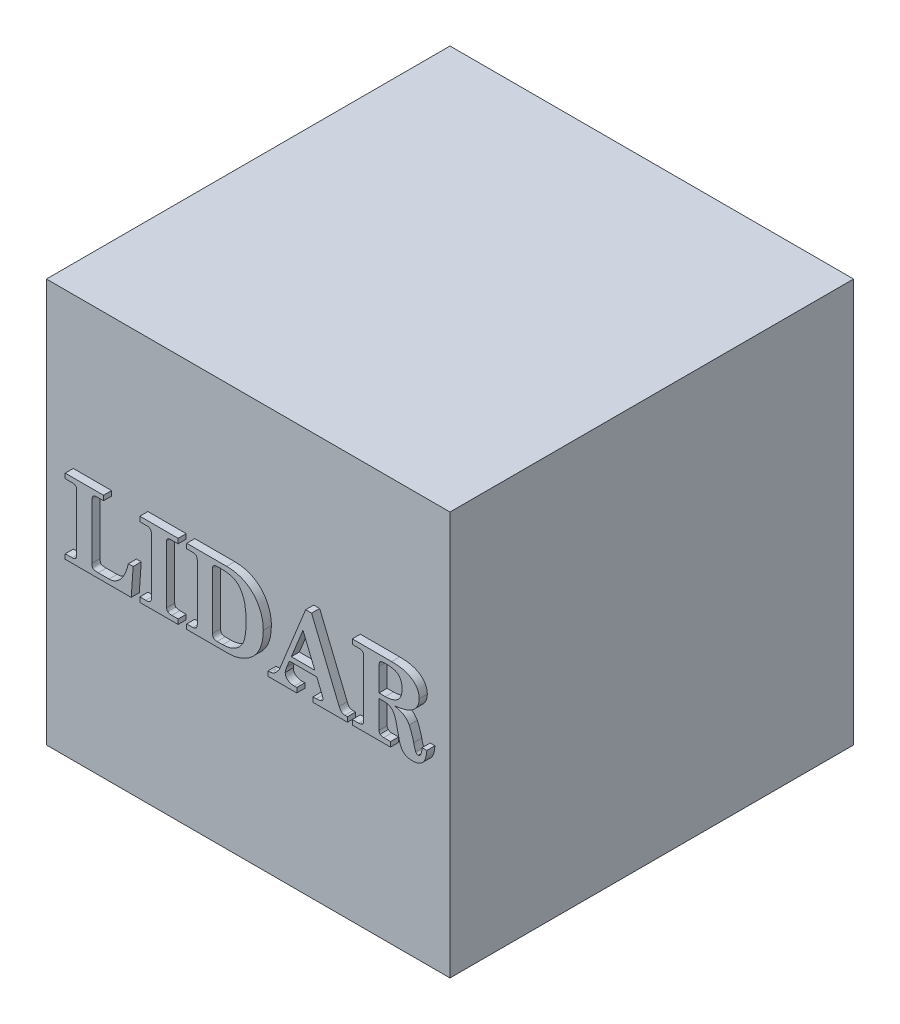
from build123d import *

# Parameters (mm, degrees)
SKETCH1_W           = 50
SKETCH1_H           = 50
BOSS_EXTRUDE1_DEPTH = 50
BOSS_EXTRUDE2_DEPTH = 1


with BuildPart() as part:
    # Sketch1 → Boss-Extrude1 (new body)
    with BuildSketch(Plane(origin=(0, 0, 0), x_dir=(1, 0, 0), z_dir=(0, 1, 0))):
        Rectangle(SKETCH1_W, SKETCH1_H)
    extrude(amount=BOSS_EXTRUDE1_DEPTH)

    # Sketch2 → Boss-Extrude2 (add)
    # profile 1 of 5: a face of its own
    with BuildSketch(Plane.XY.offset(25)):
        with BuildLine():
            Line((-21.67166408, 30.743259783), (-21.67166408, 31.33594871))
            Line((-21.67166408, 31.33594871), (-16.930152662, 31.33594871))
            Line((-16.930152662, 31.33594871), (-16.930152662, 30.743259783))
            Line((-16.930152662, 30.743259783), (-17.732134867, 30.743259783))
            add(Edge.make_bspline(
                [(-17.732134867, 30.743259783), (-17.785395123, 30.742532405), (-17.88403143, 30.741185325), (-18.019250989, 30.714301132), (-18.13106067, 30.676260377), (-18.218459156, 30.616349032), (-18.279457981, 30.535595339), (-18.322756283, 30.437503604), (-18.347754125, 30.319094115), (-18.350915588, 30.233423674), (-18.352606088, 30.187613913)],
                knots=[0, 0, 0, 0, 1.317174052, 2.439364582, 3.40274332, 4.226216974, 5.021934816, 5.877883306, 6.86526021, 8, 8, 8, 8], degree=3))
            Line((-18.352606088, 30.187613913), (-18.352606088, 23.330943886))
            add(Edge.make_bspline(
                [(-18.352606088, 23.330943886), (-18.351933156, 23.267846661), (-18.350711833, 23.153329748), (-18.324998572, 22.999808731), (-18.28729014, 22.881026478), (-18.22548858, 22.789740065), (-18.121326525, 22.738458675), (-17.984594796, 22.707359551), (-17.804369536, 22.685405408), (-17.669846737, 22.68366033), (-17.595075552, 22.682690372)],
                knots=[0, 0, 0, 0, 1.253318516, 2.274682744, 3.08242206, 3.723352428, 4.399534733, 5.325689848, 6.513550565, 8, 8, 8, 8], degree=3))
            Line((-17.595075552, 22.682690372), (-16.248560396, 22.682690372))
            add(Edge.make_bspline(
                [(-16.248560396, 22.682690372), (-16.186061304, 22.684911681), (-16.061513477, 22.689338293), (-15.877162703, 22.722496236), (-15.695405202, 22.773247908), (-15.519578701, 22.852058666), (-15.343973867, 22.945616543), (-15.173747591, 23.063802403), (-15.006077722, 23.202116505), (-14.841450493, 23.36086045), (-14.682807008, 23.543404641), (-14.534829608, 23.752254471), (-14.395996963, 23.986619867), (-14.267027413, 24.246393043), (-14.147067434, 24.530488149), (-14.035071326, 24.839204345), (-13.936566429, 25.174496039), (-13.878208196, 25.407609722), (-13.84817024, 25.527597223)],
                knots=[0, 0, 0, 0, 0.746952398, 1.488522408, 2.233867827, 2.997739128, 3.787258218, 4.610437708, 5.470623944, 6.384302497, 7.342016262, 8.35813022, 9.440650158, 10.596202486, 11.823439516, 13.126538548, 14.520981459, 16, 16, 16, 16], degree=3))
            Line((-13.84817024, 25.527597223), (-13.255481313, 25.527597223))
            Line((-13.255481313, 25.527597223), (-13.492556884, 22.090001444))
            Line((-13.492556884, 22.090001444), (-21.67166408, 22.090001444))
            Line((-21.67166408, 22.090001444), (-21.67166408, 22.682690372))
            Line((-21.67166408, 22.682690372), (-20.819673748, 22.682690372))
            add(Edge.make_bspline(
                [(-20.819673748, 22.682690372), (-20.775725801, 22.684487061), (-20.691929215, 22.68791285), (-20.574783474, 22.712742088), (-20.474869844, 22.756670447), (-20.390977358, 22.815885876), (-20.3278065, 22.894434519), (-20.279366297, 22.985026653), (-20.254459982, 23.091980068), (-20.251021274, 23.167228369), (-20.249210655, 23.206849642)],
                knots=[0, 0, 0, 0, 1.195528741, 2.279542841, 3.234602015, 4.14844858, 5.043106676, 5.952155301, 6.921726988, 8, 8, 8, 8], degree=3))
            Line((-20.249210655, 23.206849642), (-20.249210655, 30.256143571))
            add(Edge.make_bspline(
                [(-20.249210655, 30.256143571), (-20.250768412, 30.295831407), (-20.253709545, 30.370764267), (-20.281198772, 30.47485286), (-20.328575695, 30.561840477), (-20.396889387, 30.631728422), (-20.48789711, 30.68507565), (-20.604840397, 30.717896272), (-20.745971948, 30.740081095), (-20.849197471, 30.742146041), (-20.904872781, 30.743259783)],
                knots=[0, 0, 0, 0, 1.00990991, 1.906766507, 2.716615905, 3.506507968, 4.367174043, 5.37229384, 6.582730811, 8, 8, 8, 8], degree=3))
            Line((-20.904872781, 30.743259783), (-21.67166408, 30.743259783))
        make_face()
    # profile 2 of 5: a face of its own
    with BuildSketch(Plane.XY.offset(25)):
        with BuildLine():
            Line((-12.425716815, 31.33594871), (-7.684205397, 31.33594871))
            Line((-7.684205397, 31.33594871), (-7.684205397, 30.743259783))
            Line((-7.684205397, 30.743259783), (-8.565830176, 30.743259783))
            add(Edge.make_bspline(
                [(-8.565830176, 30.743259783), (-8.609767253, 30.741925445), (-8.692001207, 30.739428058), (-8.806131446, 30.719138426), (-8.902852094, 30.68750997), (-8.979914699, 30.638148777), (-9.037481067, 30.574188003), (-9.078694302, 30.498818753), (-9.103696407, 30.410178014), (-9.105631204, 30.347075568), (-9.106658822, 30.31356031)],
                knots=[0, 0, 0, 0, 1.332052342, 2.493109215, 3.506175236, 4.399811825, 5.235207467, 6.090320786, 6.985722488, 8, 8, 8, 8], degree=3))
            Line((-9.106658822, 30.31356031), (-9.106658822, 23.175363042))
            add(Edge.make_bspline(
                [(-9.106658822, 23.175363042), (-9.104913864, 23.13629211), (-9.101688951, 23.064083845), (-9.077497174, 22.963747216), (-9.036489874, 22.879161745), (-8.992567368, 22.839038771), (-8.971451661, 22.819749686)],
                knots=[0, 0, 0, 0, 1.190089479, 2.199443223, 3.134383883, 4, 4, 4, 4], degree=3))
            add(Edge.make_bspline(
                [(-8.971451661, 22.819749686), (-8.940096484, 22.798553309), (-8.874299889, 22.754074228), (-8.754701361, 22.713851199), (-8.6182541, 22.687500255), (-8.52091411, 22.684352433), (-8.469518225, 22.682690372)],
                knots=[0, 0, 0, 0, 0.855129119, 1.794427274, 2.835449219, 4, 4, 4, 4], degree=3))
            Line((-8.469518225, 22.682690372), (-7.684205397, 22.682690372))
            Line((-7.684205397, 22.682690372), (-7.684205397, 22.090001444))
            Line((-7.684205397, 22.090001444), (-12.425716815, 22.090001444))
            Line((-12.425716815, 22.090001444), (-12.425716815, 22.682690372))
            Line((-12.425716815, 22.682690372), (-11.692264267, 22.682690372))
            add(Edge.make_bspline(
                [(-11.692264267, 22.682690372), (-11.633509513, 22.68368567), (-11.524672443, 22.685529356), (-11.375683001, 22.709057712), (-11.253896858, 22.746511226), (-11.157866999, 22.8014982), (-11.086763141, 22.874500372), (-11.038426272, 22.962435929), (-11.00699507, 23.063990609), (-11.004554605, 23.136826575), (-11.003263389, 23.175363042)],
                knots=[0, 0, 0, 0, 1.452026474, 2.689728013, 3.718337889, 4.587844334, 5.397781197, 6.204689171, 7.050126734, 8, 8, 8, 8], degree=3))
            Line((-11.003263389, 23.175363042), (-11.003263389, 30.232065583))
            add(Edge.make_bspline(
                [(-11.003263389, 30.232065583), (-11.005009339, 30.272948375), (-11.008303534, 30.350084549), (-11.033362674, 30.457759381), (-11.078651943, 30.548507737), (-11.144403583, 30.621170236), (-11.228078429, 30.677956632), (-11.332136417, 30.716385758), (-11.454721937, 30.740184815), (-11.543350295, 30.742193524), (-11.590395858, 30.743259783)],
                knots=[0, 0, 0, 0, 1.095815606, 2.067545285, 2.941247535, 3.785432335, 4.66709808, 5.626336411, 6.740015708, 8, 8, 8, 8], degree=3))
            Line((-11.590395858, 30.743259783), (-12.425716815, 30.743259783))
            Line((-12.425716815, 30.743259783), (-12.425716815, 31.33594871))
        make_face()
    # profile 3 of 5: a face of its own
    with BuildSketch(Plane.XY.offset(25)):
        with BuildLine():
            Line((-6.617365327, 31.33594871), (-1.673969243, 31.33594871))
            add(Edge.make_bspline(
                [(-1.673969243, 31.33594871), (-1.563417473, 31.333987755), (-1.34509672, 31.330115205), (-1.02260868, 31.304881734), (-0.711076623, 31.257841258), (-0.409986851, 31.19457888), (-0.11827461, 31.116423292), (0.161733332, 31.014622446), (0.43294554, 30.898948435), (0.692467754, 30.763036824), (0.939484334, 30.611405197), (1.175706267, 30.446445625), (1.394543453, 30.261911061), (1.604024491, 30.066119596), (1.795545026, 29.852283594), (1.975758912, 29.624944193), (2.138714287, 29.380246768), (2.291816564, 29.123518394), (2.425201285, 28.85334409), (2.545747677, 28.575527729), (2.642311403, 28.287342683), (2.725220097, 27.992198074), (2.787103061, 27.687469429), (2.834433874, 27.37482883), (2.859789132, 27.05357712), (2.863688391, 26.837108534), (2.865657509, 26.7277923)],
                knots=[0, 0, 0, 0, 1.095124878, 2.162683496, 3.201422963, 4.213739968, 5.209254947, 6.189989335, 7.162451537, 8.128043583, 9.088801183, 10.032215269, 10.978894355, 11.921971404, 12.870209753, 13.819610945, 14.793226264, 15.780195082, 16.778467595, 17.775821777, 18.777628539, 19.786559333, 20.810849883, 21.85563876, 22.91710156, 24, 24, 24, 24], degree=3))
            add(Edge.make_bspline(
                [(2.865657509, 26.7277923), (2.864642001, 26.614749213), (2.862641448, 26.392054078), (2.834609377, 26.063335619), (2.795401064, 25.745317741), (2.737647861, 25.438555148), (2.663703545, 25.143441406), (2.572940868, 24.859393305), (2.465281343, 24.586542756), (2.341698767, 24.324930388), (2.199595134, 24.076501272), (2.04530393, 23.838511095), (1.870984829, 23.615613973), (1.683043039, 23.403760339), (1.475285789, 23.20735953), (1.253884883, 23.021182271), (1.013137443, 22.851775219), (0.761215469, 22.69239906), (0.498065227, 22.550942276), (0.228183448, 22.428100097), (-0.046508876, 22.324104925), (-0.326787281, 22.238666298), (-0.612091519, 22.172230872), (-0.902088161, 22.123411564), (-1.196789673, 22.095433619), (-1.39485453, 22.091817324), (-1.494310412, 22.090001444)],
                knots=[0, 0, 0, 0, 1.13887174, 2.243579878, 3.322457727, 4.367025756, 5.387125682, 6.38669751, 7.369928061, 8.341215495, 9.299704588, 10.252278776, 11.196874661, 12.148635726, 13.103584326, 14.075469414, 15.061295075, 16.067717662, 17.078228411, 18.069458256, 19.054006876, 20.036134399, 21.020132398, 22.004130398, 22.997798122, 24, 24, 24, 24], degree=3))
            Line((-1.494310412, 22.090001444), (-6.617365327, 22.090001444))
            Line((-6.617365327, 22.090001444), (-6.617365327, 22.682690372))
            Line((-6.617365327, 22.682690372), (-5.867243404, 22.682690372))
            add(Edge.make_bspline(
                [(-5.867243404, 22.682690372), (-5.824424665, 22.684073905), (-5.74257352, 22.68671863), (-5.629003312, 22.717192303), (-5.530226102, 22.763293599), (-5.450405683, 22.832361757), (-5.389810232, 22.91901695), (-5.343676178, 23.01975879), (-5.31869368, 23.136516595), (-5.31525441, 23.219086512), (-5.313449687, 23.262414229)],
                knots=[0, 0, 0, 0, 1.122856504, 2.146422164, 3.068293037, 3.966132366, 4.88499783, 5.829313612, 6.860954614, 8, 8, 8, 8], degree=3))
            Line((-5.313449687, 23.262414229), (-5.313449687, 30.207987595))
            add(Edge.make_bspline(
                [(-5.313449687, 30.207987595), (-5.315018456, 30.251369305), (-5.317991441, 30.333582328), (-5.345251681, 30.447019352), (-5.39053667, 30.543093527), (-5.45745519, 30.619927785), (-5.548230178, 30.677285398), (-5.66136241, 30.716847223), (-5.798990554, 30.740368729), (-5.898625772, 30.742245869), (-5.952442437, 30.743259783)],
                knots=[0, 0, 0, 0, 1.078064526, 2.043048672, 2.881216632, 3.697706621, 4.541346901, 5.523059816, 6.66211301, 8, 8, 8, 8], degree=3))
            Line((-5.952442437, 30.743259783), (-6.617365327, 30.743259783))
            Line((-6.617365327, 30.743259783), (-6.617365327, 31.33594871))
        make_face()
        with BuildLine():
            add(Edge.make_bspline(
                [(-2.153676844, 22.682690372), (-2.080160264, 22.684200876), (-1.935314264, 22.687176946), (-1.721254536, 22.708161223), (-1.513415086, 22.741487249), (-1.311236267, 22.787000314), (-1.116506056, 22.84872264), (-0.928405006, 22.923134933), (-0.746573309, 23.010599686), (-0.57067308, 23.109729663), (-0.405035083, 23.223079783), (-0.248252361, 23.344619744), (-0.106428969, 23.478553457), (0.024969163, 23.62026226), (0.143756652, 23.772797889), (0.250504391, 23.935263087), (0.346300429, 24.106898248), (0.428565208, 24.291824953), (0.501333121, 24.494103969), (0.564539697, 24.719256238), (0.614692635, 24.970947274), (0.659610305, 25.24693647), (0.6918528, 25.549325969), (0.716262336, 25.876680363), (0.727949363, 26.23009776), (0.730605808, 26.474041774), (0.731977371, 26.59999375)],
                knots=[0, 0, 0, 0, 0.949765025, 1.871273987, 2.776130108, 3.66816782, 4.546113786, 5.412643397, 6.279613467, 7.151267918, 8.018531503, 8.870659598, 9.711550513, 10.535742305, 11.365473911, 12.206175636, 13.045248569, 13.902142185, 14.818075952, 15.820638119, 16.9204126, 18.132138158, 19.432318017, 20.847999306, 22.372574464, 24, 24, 24, 24], degree=3))
            add(Edge.make_bspline(
                [(0.731977371, 26.59999375), (0.731000493, 26.733370139), (0.729104717, 26.992206665), (0.711961982, 27.368367336), (0.685750154, 27.72075872), (0.643726695, 28.04854107), (0.59622288, 28.352714959), (0.531506856, 28.631550496), (0.461592013, 28.88810985), (0.375168661, 29.120753979), (0.280003145, 29.333016181), (0.178239198, 29.529055398), (0.06673898, 29.708733846), (-0.051335447, 29.873935511), (-0.177395615, 30.023605592), (-0.313664625, 30.155099159), (-0.456004511, 30.272697266), (-0.608761079, 30.374271167), (-0.774730107, 30.462856697), (-0.957820405, 30.538246376), (-1.159242276, 30.599878669), (-1.377046539, 30.654899826), (-1.613688209, 30.694672693), (-1.868617703, 30.720990644), (-2.141016692, 30.741030106), (-2.328973378, 30.74250095), (-2.42594332, 30.743259783)],
                knots=[0, 0, 0, 0, 1.586297713, 3.07844435, 4.478005486, 5.787764439, 7.008271247, 8.137702286, 9.190763021, 10.168851427, 11.085936446, 11.956353167, 12.7939037, 13.598887414, 14.369895025, 15.117682938, 15.848254541, 16.563120313, 17.29571888, 18.082579543, 18.914023681, 19.799183864, 20.752903796, 21.764942868, 22.846897305, 24, 24, 24, 24], degree=3))
            add(Edge.make_bspline(
                [(-2.42594332, 30.743259783), (-2.478429612, 30.743008971), (-2.577878122, 30.742533744), (-2.719868949, 30.736212323), (-2.845943116, 30.729721998), (-2.957396668, 30.719255581), (-3.052503438, 30.702521417), (-3.132785829, 30.683852086), (-3.19918032, 30.665210973), (-3.264599941, 30.631110588), (-3.329116265, 30.575235416), (-3.382398088, 30.485944607), (-3.410692197, 30.37448136), (-3.414691022, 30.293961674), (-3.41684512, 30.250587112)],
                knots=[0, 0, 0, 0, 1.479388087, 2.803073613, 4.005921637, 5.038015802, 5.956445119, 6.724759669, 7.363251975, 7.892554548, 8.792999824, 9.730199517, 10.777297743, 12, 12, 12, 12], degree=3))
            Line((-3.41684512, 30.250587112), (-3.41684512, 23.26982284))
            add(Edge.make_bspline(
                [(-3.41684512, 23.26982284), (-3.414996453, 23.220965771), (-3.411576798, 23.130590215), (-3.388878827, 23.004628631), (-3.346213671, 22.901262999), (-3.287654633, 22.816708142), (-3.206576103, 22.754727784), (-3.106904152, 22.713760796), (-2.988499761, 22.687122688), (-2.90334927, 22.684241772), (-2.857494945, 22.682690372)],
                knots=[0, 0, 0, 0, 1.25011308, 2.312452742, 3.253936465, 4.091094141, 4.912462066, 5.824887263, 6.828681705, 8, 8, 8, 8], degree=3))
            Line((-2.857494945, 22.682690372), (-2.153676844, 22.682690372))
        make_face(mode=Mode.SUBTRACT)
    # profile 4 of 5: a face of its own
    with BuildSketch(Plane.XY.offset(25)):
        with BuildLine():
            Line((8.849963522, 31.573024281), (12.267185618, 23.271674993))
            add(Edge.make_bspline(
                [(12.267185618, 23.271674993), (12.289712528, 23.218764772), (12.331626789, 23.120318391), (12.403915341, 22.988723684), (12.478998127, 22.883963932), (12.5591395, 22.802923047), (12.650418185, 22.747196486), (12.752269562, 22.711581766), (12.865377115, 22.685527562), (12.945520502, 22.683668285), (12.987673095, 22.682690372)],
                knots=[0, 0, 0, 0, 1.370087271, 2.549226437, 3.57052343, 4.434214329, 5.246883247, 6.094249163, 6.997642324, 8, 8, 8, 8], degree=3))
            Line((12.987673095, 22.682690372), (13.296982629, 22.682690372))
            Line((13.296982629, 22.682690372), (13.296982629, 22.090001444))
            Line((13.296982629, 22.090001444), (9.029622353, 22.090001444))
            Line((9.029622353, 22.090001444), (9.029622353, 22.682690372))
            Line((9.029622353, 22.682690372), (9.429687379, 22.682690372))
            add(Edge.make_bspline(
                [(9.429687379, 22.682690372), (9.50255491, 22.684262903), (9.635604924, 22.687134215), (9.817837162, 22.703374873), (9.962831831, 22.735813533), (10.076624519, 22.778710998), (10.1568428, 22.839652385), (10.217126116, 22.904066276), (10.253510628, 22.980690462), (10.257449611, 23.034850875), (10.259451877, 23.062381716)],
                knots=[0, 0, 0, 0, 1.734001692, 3.166141951, 4.34179556, 5.263658256, 6.030315746, 6.716978054, 7.34781383, 8, 8, 8, 8], degree=3))
            add(Edge.make_bspline(
                [(10.259451877, 23.062381716), (10.255416599, 23.111641911), (10.246573858, 23.219588647), (10.206922628, 23.320521951), (10.185365761, 23.375395555)],
                knots=[0, 0, 0, 0, 0.912675961, 2, 2, 2, 2], degree=3))
            Line((10.185365761, 23.375395555), (9.49451273, 25.053446081))
            Line((9.49451273, 25.053446081), (6.101368621, 25.053446081))
            Line((6.101368621, 25.053446081), (5.790206935, 24.288506934))
            add(Edge.make_bspline(
                [(5.790206935, 24.288506934), (5.758971037, 24.21416554), (5.701479354, 24.077335417), (5.636107218, 23.883919065), (5.592936503, 23.72113456), (5.58587793, 23.62129807), (5.58276581, 23.577280221)],
                knots=[0, 0, 0, 0, 1.298659012, 2.390265557, 3.29026905, 4, 4, 4, 4], degree=3))
            add(Edge.make_bspline(
                [(5.58276581, 23.577280221), (5.585958987, 23.513830326), (5.592206434, 23.389690696), (5.652175419, 23.213878518), (5.749422683, 23.057059091), (5.885399226, 22.923771256), (6.05210611, 22.813603472), (6.250910672, 22.738816979), (6.474275116, 22.688974874), (6.633252354, 22.684846532), (6.716283384, 22.682690372)],
                knots=[0, 0, 0, 0, 0.936681703, 1.832616438, 2.715165993, 3.645764122, 4.629294347, 5.650980637, 6.773148287, 8, 8, 8, 8], degree=3))
            Line((6.716283384, 22.682690372), (7.01448, 22.682690372))
            Line((7.01448, 22.682690372), (7.01448, 22.090001444))
            Line((7.01448, 22.090001444), (3.458346436, 22.090001444))
            Line((3.458346436, 22.090001444), (3.458346436, 22.682690372))
            Line((3.458346436, 22.682690372), (3.67134402, 22.682690372))
            add(Edge.make_bspline(
                [(3.67134402, 22.682690372), (3.72962634, 22.685029686), (3.843848017, 22.689614275), (4.008956617, 22.730277522), (4.163973862, 22.794540842), (4.255160404, 22.858118121), (4.301076005, 22.890131496)],
                knots=[0, 0, 0, 0, 1.034931053, 2.028257604, 3.007159006, 4, 4, 4, 4], degree=3))
            add(Edge.make_bspline(
                [(4.301076005, 22.890131496), (4.362945734, 22.941140065), (4.486604261, 23.043090477), (4.648298759, 23.223276387), (4.788481458, 23.423652926), (4.862163903, 23.57010372), (4.899321391, 23.643957726)],
                knots=[0, 0, 0, 0, 0.989267864, 1.977241644, 2.979938569, 4, 4, 4, 4], degree=3))
            Line((4.899321391, 23.643957726), (8.114658821, 31.573024281))
            Line((8.114658821, 31.573024281), (8.849963522, 31.573024281))
        make_face()
        Polygon((7.784975606, 29.20782503), (6.340296345, 25.646135008), (9.250028548, 25.646135008), align=None, mode=Mode.SUBTRACT)
    # profile 5 of 5: a face of its own
    with BuildSketch(Plane.XY.offset(25)):
        with BuildLine():
            Line((13.889671557, 31.33594871), (18.768242289, 31.33594871))
            add(Edge.make_bspline(
                [(18.768242289, 31.33594871), (18.865180036, 31.334577055), (19.054200687, 31.331902442), (19.331107463, 31.319949023), (19.594258952, 31.295380937), (19.844005847, 31.262659209), (20.079501281, 31.220060702), (20.301289182, 31.169005288), (20.508415291, 31.105000483), (20.703898113, 31.035694275), (20.884925057, 30.955219962), (21.054809675, 30.870169842), (21.212672265, 30.777451622), (21.358584842, 30.677668815), (21.493153365, 30.572168477), (21.614052841, 30.458236002), (21.723884747, 30.337623301), (21.853087321, 30.168914556), (21.987465994, 29.945665677), (22.104335102, 29.659871041), (22.175232237, 29.358835574), (22.183262513, 29.152637459), (22.187316539, 29.048539881)],
                knots=[0, 0, 0, 0, 1.260796864, 2.458450407, 3.603348749, 4.696868034, 5.733149247, 6.714703153, 7.654483761, 8.551049231, 9.410311666, 10.229003047, 11.020794849, 11.789116025, 12.526438116, 13.242153704, 13.946977727, 14.645554491, 16.003253973, 17.321296627, 18.647676625, 20, 20, 20, 20], degree=3))
            add(Edge.make_bspline(
                [(22.187316539, 29.048539881), (22.184419206, 28.965623272), (22.178714946, 28.802377272), (22.13499761, 28.563247798), (22.06348981, 28.335996191), (21.959242866, 28.122679254), (21.828624088, 27.920668683), (21.667890901, 27.731160095), (21.478100957, 27.5540954), (21.334699891, 27.451055639), (21.26124009, 27.398271649)],
                knots=[0, 0, 0, 0, 1.006615866, 1.981822625, 2.942272039, 3.891414032, 4.85650664, 5.856958922, 6.902188287, 8, 8, 8, 8], degree=3))
            add(Edge.make_bspline(
                [(21.26124009, 27.398271649), (21.199562417, 27.358822683), (21.071086254, 27.276649483), (20.857868895, 27.172716843), (20.620700475, 27.080530307), (20.360778823, 26.997559363), (20.077669414, 26.923747125), (19.770389049, 26.860989574), (19.439691896, 26.809311235), (19.210412171, 26.784841862), (19.092369046, 26.77224397)],
                knots=[0, 0, 0, 0, 0.770522959, 1.605018928, 2.492419048, 3.448517842, 4.476706657, 5.572020456, 6.749971061, 8, 8, 8, 8], degree=3))
            add(Edge.make_bspline(
                [(19.092369046, 26.77224397), (19.209423895, 26.751189402), (19.431175784, 26.711303056), (19.740066044, 26.62741439), (20.005916621, 26.52372647), (20.235662001, 26.401750774), (20.435962293, 26.251182564), (20.619973446, 26.073977084), (20.791584528, 25.864661007), (20.891190457, 25.708382765), (20.942669791, 25.627613479)],
                knots=[0, 0, 0, 0, 1.260855103, 2.388598191, 3.387941535, 4.281421676, 5.137767289, 6.036055688, 6.984974634, 8, 8, 8, 8], degree=3))
            add(Edge.make_bspline(
                [(20.942669791, 25.627613479), (20.998818345, 25.50861053), (21.114598666, 25.263222202), (21.257911538, 24.868169415), (21.391379622, 24.44162196), (21.461918867, 24.142697176), (21.498315661, 23.988458165)],
                knots=[0, 0, 0, 0, 0.909803941, 1.87604819, 2.904084753, 4, 4, 4, 4], degree=3))
            add(Edge.make_bspline(
                [(21.498315661, 23.988458165), (21.519920525, 23.894463497), (21.559745728, 23.721198969), (21.622883878, 23.48630443), (21.686380052, 23.299116446), (21.734694579, 23.193598104), (21.755764913, 23.147580749)],
                knots=[0, 0, 0, 0, 1.313125144, 2.420541671, 3.311186147, 4, 4, 4, 4], degree=3))
            add(Edge.make_bspline(
                [(21.755764913, 23.147580749), (21.775276068, 23.113129474), (21.811003977, 23.050043919), (21.880859218, 22.978422926), (21.954071219, 22.929071509), (22.007630223, 22.922803677), (22.033587848, 22.919765943)],
                knots=[0, 0, 0, 0, 1.257126063, 2.301990172, 3.177051494, 4, 4, 4, 4], degree=3))
            add(Edge.make_bspline(
                [(22.033587848, 22.919765943), (22.068269222, 22.922761478), (22.13722199, 22.928717139), (22.231475983, 22.985446056), (22.311734602, 23.072739819), (22.38214683, 23.19192841), (22.437247282, 23.344998895), (22.485038481, 23.529077015), (22.521282363, 23.746665218), (22.535399134, 23.903135211), (22.542929895, 23.986606012)],
                knots=[0, 0, 0, 0, 0.646043871, 1.28445065, 2.005958554, 2.858823567, 3.864198261, 5.050731084, 6.426677019, 8, 8, 8, 8], degree=3))
            Line((22.542929895, 23.986606012), (23.135618822, 23.986606012))
            add(Edge.make_bspline(
                [(23.135618822, 23.986606012), (23.129150487, 23.899462333), (23.11668323, 23.731499066), (23.083424211, 23.489545543), (23.038213471, 23.266999291), (22.977872532, 23.063745018), (22.909360454, 22.877898075), (22.824877505, 22.712210444), (22.73141646, 22.563949313), (22.622022502, 22.437148421), (22.502413739, 22.325976577), (22.369471336, 22.232034806), (22.227124119, 22.149171251), (22.070836986, 22.085090199), (21.904519272, 22.032180969), (21.725303253, 21.99878354), (21.535370221, 21.975160164), (21.404553896, 21.97272029), (21.337178358, 21.971463659)],
                knots=[0, 0, 0, 0, 1.367110356, 2.635008363, 3.819206984, 4.916686227, 5.950176123, 6.913653537, 7.822085834, 8.685534134, 9.526475961, 10.371017135, 11.227791915, 12.098023441, 13.008610734, 13.954046558, 14.946253751, 16, 16, 16, 16], degree=3))
            add(Edge.make_bspline(
                [(21.337178358, 21.971463659), (21.243108119, 21.973787376), (21.064185572, 21.978207111), (20.809671283, 22.025524149), (20.583763859, 22.101652138), (20.386225984, 22.211928191), (20.214691886, 22.35132679), (20.068037799, 22.521140697), (19.93978995, 22.716842574), (19.876756594, 22.863085415), (19.844343123, 22.938287472)],
                knots=[0, 0, 0, 0, 1.180805118, 2.245903272, 3.239527271, 4.163314747, 5.073219269, 6.002236293, 6.972695423, 8, 8, 8, 8], degree=3))
            add(Edge.make_bspline(
                [(19.844343123, 22.938287472), (19.83413793, 22.964722476), (19.811127976, 23.024326267), (19.780805594, 23.127497886), (19.745293155, 23.252586212), (19.709156766, 23.401187661), (19.668060296, 23.572116644), (19.623693496, 23.765873235), (19.577274302, 23.98319175), (19.54715905, 24.135967827), (19.531329283, 24.216272971)],
                knots=[0, 0, 0, 0, 0.51621077, 1.16391579, 1.958305469, 2.886107817, 3.950407662, 5.162257264, 6.508370262, 8, 8, 8, 8], degree=3))
            add(Edge.make_bspline(
                [(19.531329283, 24.216272971), (19.512377334, 24.310153343), (19.476052886, 24.490090118), (19.420821162, 24.748397554), (19.365503939, 24.98234862), (19.311788398, 25.192297731), (19.260285018, 25.377683156), (19.210323799, 25.538898142), (19.163330474, 25.676799145), (19.100057815, 25.82456937), (19.016339995, 25.982855681), (18.904625679, 26.149952514), (18.775031602, 26.288293802), (18.632563428, 26.402851904), (18.471639562, 26.48779158), (18.295927862, 26.552873905), (18.100866251, 26.586387857), (17.965749494, 26.5916936), (17.895878274, 26.594437292)],
                knots=[0, 0, 0, 0, 1.442191922, 2.764191877, 3.977370359, 5.061944357, 6.027372746, 6.874242926, 7.603428871, 8.219893778, 9.292850582, 10.295949872, 11.236574786, 12.136774613, 13.035292675, 13.964593533, 14.947456001, 16, 16, 16, 16], degree=3))
            Line((17.895878274, 26.594437292), (17.208729549, 26.594437292))
            Line((17.208729549, 26.594437292), (17.208729549, 23.182771654))
            add(Edge.make_bspline(
                [(17.208729549, 23.182771654), (17.210659843, 23.147447914), (17.21433298, 23.080230714), (17.237842863, 22.984998143), (17.281019583, 22.903110781), (17.321907498, 22.859695474), (17.342084558, 22.838271215)],
                knots=[0, 0, 0, 0, 1.11562849, 2.122918543, 3.073711999, 4, 4, 4, 4], degree=3))
            add(Edge.make_bspline(
                [(17.342084558, 22.838271215), (17.373948379, 22.814001203), (17.437145369, 22.765865366), (17.547081824, 22.718934555), (17.663172851, 22.687146721), (17.743778446, 22.684192142), (17.784749101, 22.682690372)],
                knots=[0, 0, 0, 0, 1.000506897, 1.984351599, 2.975475153, 4, 4, 4, 4], degree=3))
            Line((17.784749101, 22.682690372), (18.631182975, 22.682690372))
            Line((18.631182975, 22.682690372), (18.631182975, 22.090001444))
            Line((18.631182975, 22.090001444), (13.889671557, 22.090001444))
            Line((13.889671557, 22.090001444), (13.889671557, 22.682690372))
            Line((13.889671557, 22.682690372), (14.686097303, 22.682690372))
            add(Edge.make_bspline(
                [(14.686097303, 22.682690372), (14.734411237, 22.684263096), (14.826373086, 22.687256654), (14.954134225, 22.714794367), (15.064976641, 22.759213391), (15.154301281, 22.825523348), (15.227651249, 22.906511163), (15.277242081, 23.005132867), (15.308058433, 23.117334716), (15.310727481, 23.196753146), (15.312124982, 23.238336241)],
                knots=[0, 0, 0, 0, 1.215748592, 2.314083659, 3.276082243, 4.200108988, 5.092704252, 6.004076111, 6.954944175, 8, 8, 8, 8], degree=3))
            Line((15.312124982, 23.238336241), (15.312124982, 30.187613913))
            add(Edge.make_bspline(
                [(15.312124982, 30.187613913), (15.31036057, 30.232177351), (15.307042293, 30.315986498), (15.282315624, 30.433730875), (15.235742924, 30.532119522), (15.170275045, 30.611153249), (15.088168587, 30.671660359), (14.990168296, 30.714461813), (14.876687708, 30.737629366), (14.796711134, 30.741318524), (14.75462696, 30.743259783)],
                knots=[0, 0, 0, 0, 1.186255313, 2.230955505, 3.179282011, 4.054730626, 4.935716216, 5.870269018, 6.87932221, 8, 8, 8, 8], degree=3))
            Line((14.75462696, 30.743259783), (13.889671557, 30.743259783))
            Line((13.889671557, 30.743259783), (13.889671557, 31.33594871))
        make_face()
        with BuildLine():
            Line((17.208729549, 27.187126219), (17.982929461, 27.187126219))
            add(Edge.make_bspline(
                [(17.982929461, 27.187126219), (18.066361113, 27.188112428), (18.229335182, 27.190038874), (18.466858613, 27.217758537), (18.691372337, 27.257036916), (18.902257729, 27.314631212), (19.098993525, 27.389350783), (19.283996733, 27.477286248), (19.453489168, 27.585558394), (19.556181052, 27.669517868), (19.607267552, 27.711285489)],
                knots=[0, 0, 0, 0, 1.146952266, 2.240438413, 3.284842864, 4.279918954, 5.24205365, 6.176390374, 7.092802377, 8, 8, 8, 8], degree=3))
            add(Edge.make_bspline(
                [(19.607267552, 27.711285489), (19.642929179, 27.746762971), (19.715335426, 27.818795335), (19.805590453, 27.94703501), (19.883982177, 28.090259932), (19.947155897, 28.251475875), (19.994034075, 28.430069119), (20.029446785, 28.62506533), (20.04926908, 28.837604491), (20.052142352, 28.984909199), (20.0536364, 29.061504952)],
                knots=[0, 0, 0, 0, 0.823637118, 1.672286907, 2.560369197, 3.496721298, 4.503762865, 5.584178681, 6.743817119, 8, 8, 8, 8], degree=3))
            add(Edge.make_bspline(
                [(20.0536364, 29.061504952), (20.052182773, 29.131940392), (20.049371105, 29.268179639), (20.02873797, 29.4650699), (19.996042002, 29.648096731), (19.948755, 29.816707004), (19.885241273, 29.969939991), (19.808490659, 30.108237294), (19.720379474, 30.233783211), (19.614131114, 30.342826202), (19.492281384, 30.438491645), (19.350592703, 30.520678821), (19.189423646, 30.590042406), (19.007937302, 30.648363396), (18.805774755, 30.688776914), (18.584407551, 30.720049057), (18.343275444, 30.741421119), (18.175602029, 30.742631195), (18.088502176, 30.743259783)],
                knots=[0, 0, 0, 0, 1.12607714, 2.178106663, 3.161725867, 4.096006619, 4.972319557, 5.807464053, 6.621093994, 7.416983527, 8.232587358, 9.090979501, 10.028176308, 11.033452721, 12.133172423, 13.319842628, 14.607761926, 16, 16, 16, 16], degree=3))
            add(Edge.make_bspline(
                [(18.088502176, 30.743259783), (18.042200709, 30.742868997), (17.954498836, 30.742128791), (17.828923772, 30.737578031), (17.717365181, 30.725219464), (17.618459608, 30.714538149), (17.534369201, 30.694129861), (17.461865135, 30.676230967), (17.403559441, 30.649687687), (17.340578937, 30.609713443), (17.283345917, 30.529097116), (17.238413946, 30.40359086), (17.21278551, 30.24044784), (17.210169587, 30.119169278), (17.208729549, 30.052406752)],
                knots=[0, 0, 0, 0, 1.234073475, 2.337518953, 3.345986092, 4.225559855, 4.983998792, 5.650694609, 6.210333431, 6.684906202, 7.622862998, 8.768671454, 10.221188891, 12, 12, 12, 12], degree=3))
            Line((17.208729549, 30.052406752), (17.208729549, 27.187126219))
        make_face(mode=Mode.SUBTRACT)
    extrude(amount=BOSS_EXTRUDE2_DEPTH)


solid = part.part
